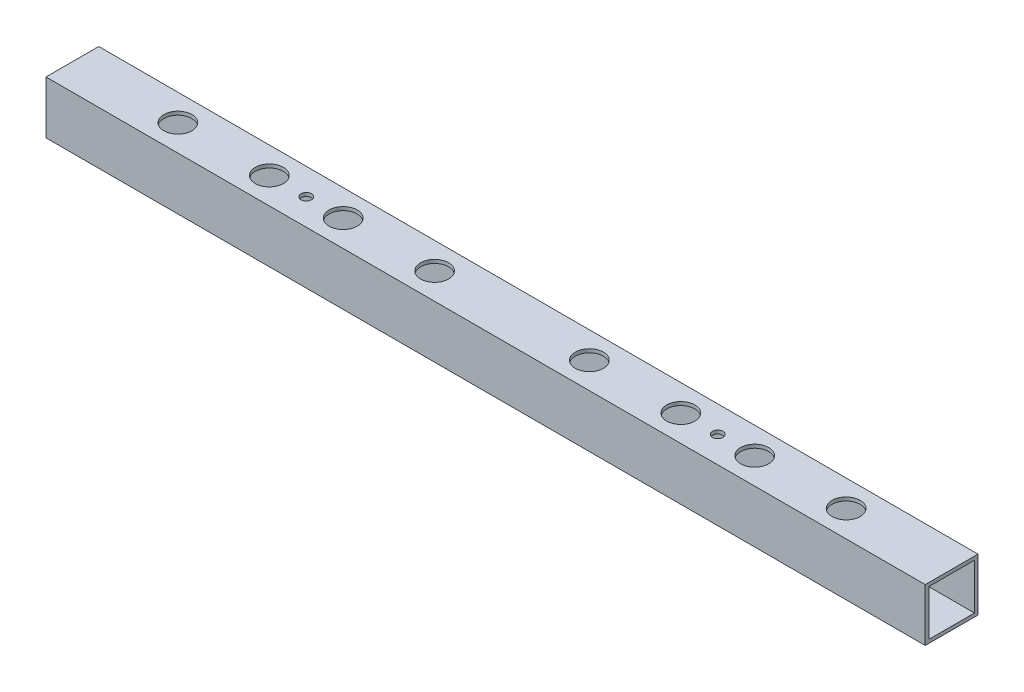
from build123d import *

# Parameters (mm, degrees)
SKETCH_1_W          = 15
SKETCH_1_H          = 15
SKETCH_1_W_2        = 13
SKETCH_1_H_2        = 13
EXTRUDE_1_DEPTH     = 250
SKETCH_2_R          = 1.5
CUT_EXTRUDE_1_DEPTH = 250
SKETCH_3_R          = 4
CUT_EXTRUDE_2_DEPTH = 10
SKETCH_4_R          = 4
CUT_EXTRUDE_3_DEPTH = 10


with BuildPart() as part:
    # 草图1 → 凸台-拉伸1 (new body)
    with BuildSketch(Plane(origin=(0, 0, 0), x_dir=(0, 0, -1), z_dir=(1, 0, 0))):
        Rectangle(SKETCH_1_W, SKETCH_1_H)
        Rectangle(SKETCH_1_W_2, SKETCH_1_H_2, mode=Mode.SUBTRACT)
    extrude(amount=EXTRUDE_1_DEPTH)

    # 草图2 → 切除-拉伸1 (cut)
    with BuildSketch(Plane(origin=(0, 7.5, 0), x_dir=(1, 0, 0), z_dir=(0, 1, 0))):
        with Locations(Location((30, 0, 0), (0, 0, 270))):
            Circle(SKETCH_2_R)
        with Locations(Location((56, 0, 0), (0, 0, 270))):
            Circle(SKETCH_2_R)
        with Locations(Location((66.5, 0, 0), (0, 0, 270))):
            Circle(SKETCH_2_R)
        with Locations(Location((103, 0, 0), (0, 0, 270))):
            Circle(SKETCH_2_R)
        with Locations(Location((77, 0, 0), (0, 0, 270))):
            Circle(SKETCH_2_R)
        with Locations(Location((173, 0, 0), (0, 0, 90))):
            Circle(SKETCH_2_R)
        with Locations(Location((147, 0, 0), (0, 0, 90))):
            Circle(SKETCH_2_R)
        with Locations(Location((183.5, 0, 0), (0, 0, 90))):
            Circle(SKETCH_2_R)
        with Locations(Location((194, 0, 0), (0, 0, 90))):
            Circle(SKETCH_2_R)
        with Locations(Location((220, 0, 0), (0, 0, 90))):
            Circle(SKETCH_2_R)
    extrude(amount=-CUT_EXTRUDE_1_DEPTH, mode=Mode.SUBTRACT)

    # 草图3 → 切除-拉伸2 (cut)
    with BuildSketch(Plane(origin=(0, 7.5, 0), x_dir=(1, 0, 0), z_dir=(0, 1, 0))):
        with Locations(Location((30, 0, 0), (0, 0, 270))):
            Circle(SKETCH_3_R)
        with Locations(Location((56, 0, 0), (0, 0, 270))):
            Circle(SKETCH_3_R)
        with Locations(Location((103, 0, 0), (0, 0, 270))):
            Circle(SKETCH_3_R)
        with Locations(Location((173, 0, 0), (0, 0, 270))):
            Circle(SKETCH_3_R)
        with Locations(Location((77, 0, 0), (0, 0, 270))):
            Circle(SKETCH_3_R)
        with Locations(Location((147, 0, 0), (0, 0, 90))):
            Circle(SKETCH_3_R)
        with Locations(Location((194, 0, 0), (0, 0, 90))):
            Circle(SKETCH_3_R)
        with Locations(Location((220, 0, 0), (0, 0, 90))):
            Circle(SKETCH_3_R)
    extrude(amount=-CUT_EXTRUDE_2_DEPTH, mode=Mode.SUBTRACT)

    # 草图4 → 切除-拉伸3 (cut)
    with BuildSketch(Plane.XZ.offset(7.5)):
        with Locations(Location((66.5, 0, 0), (0, 0, 270))):
            Circle(SKETCH_4_R)
        with Locations(Location((183.5, 0, 0), (0, 0, 270))):
            Circle(SKETCH_4_R)
    extrude(amount=-CUT_EXTRUDE_3_DEPTH, mode=Mode.SUBTRACT)


solid = part.part
